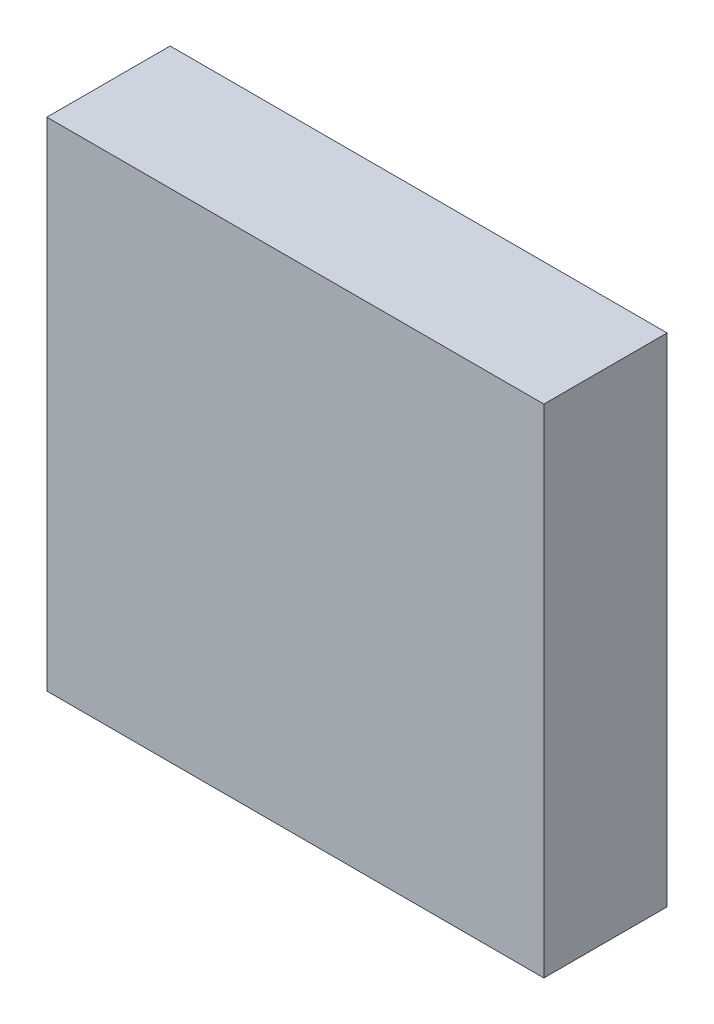
from build123d import *

# Parameters (mm, degrees)
SKETCH1_W               = 4.032
SKETCH1_H               = 4.032
COMPONENT_OUTLINE_DEPTH = 1


with BuildPart() as part:
    # Sketch1 → Component_Outline (new body)
    with BuildSketch(Plane.XY):
        Rectangle(SKETCH1_W, SKETCH1_H)
    extrude(amount=COMPONENT_OUTLINE_DEPTH)


solid = part.part
